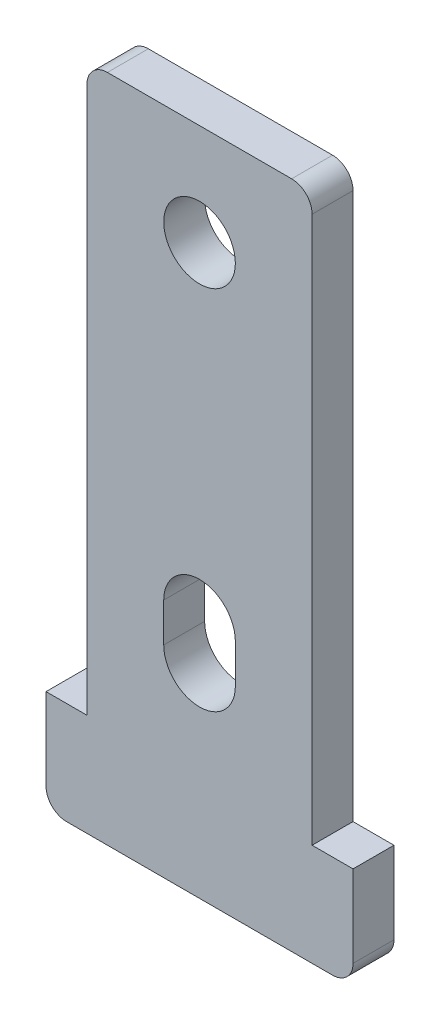
from build123d import *

# Parameters (mm, degrees)
IZIM1_R                     = 1.75
Y_KSEKLIK_EKSTR_ZYON1_DEPTH = 2


with BuildPart() as part:
    # Çizim1 → Yükseklik-Ekstrüzyon1 (new body)
    with BuildSketch(Plane.XY):
        with BuildLine():
            Line((-4.459459459, -15.675675676), (-6.459459459, -15.675675676))
            Line((-6.459459459, -15.675675676), (-6.459459459, -19.675675676))
            ThreePointArc((-6.459459459, -19.675675676), (-6.166566241, -20.382782457), (-5.459459459, -20.675675676))
            Line((-5.459459459, -20.675675676), (7.540540541, -20.675675676))
            ThreePointArc((7.540540541, -20.675675676), (8.247647322, -20.382782457), (8.540540541, -19.675675676))
            Line((8.540540541, -19.675675676), (8.540540541, -15.675675676))
            Line((8.540540541, -15.675675676), (6.540540541, -15.675675676))
            Line((6.540540541, -15.675675676), (6.540540541, 11.024324324))
            ThreePointArc((6.540540541, 11.024324324), (6.247647322, 11.731431106), (5.540540541, 12.024324324))
            Line((5.540540541, 12.024324324), (-3.459459459, 12.024324324))
            ThreePointArc((-3.459459459, 12.024324324), (-4.166566241, 11.731431106), (-4.459459459, 11.024324324))
            Line((-4.459459459, 11.024324324), (-4.459459459, -15.675675676))
        make_face()
        with Locations((1.040540541, 7.074324324)):
            Circle(IZIM1_R, mode=Mode.SUBTRACT)
        with BuildLine():
            Line((-0.709459459, -10.825675676), (-0.709459459, -8.925675676))
            ThreePointArc((-0.709459459, -8.925675676), (1.040540541, -7.175675676), (2.790540541, -8.925675676))
            Line((2.790540541, -8.925675676), (2.790540541, -10.825675676))
            ThreePointArc((2.790540541, -10.825675676), (1.040540541, -12.575675676), (-0.709459459, -10.825675676))
        make_face(mode=Mode.SUBTRACT)
    extrude(amount=Y_KSEKLIK_EKSTR_ZYON1_DEPTH)


solid = part.part
